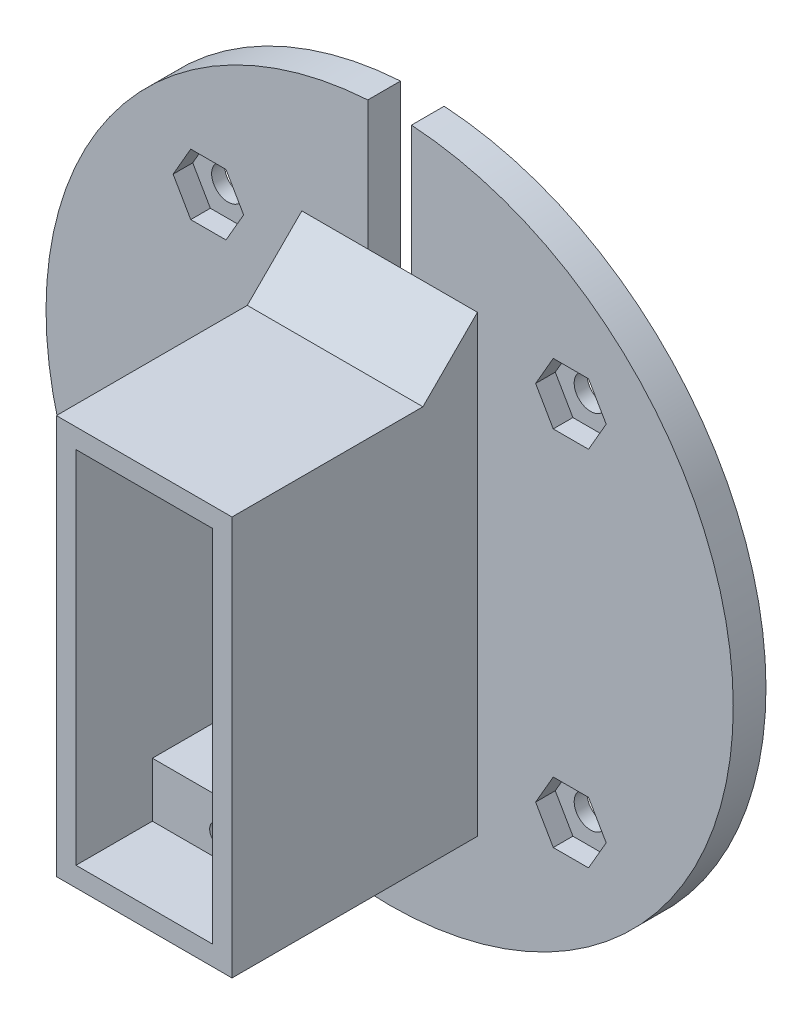
from build123d import *

# Parameters (mm, degrees)
CROQUIS1_R              = 31.5
SALIENTE_EXTRUIR1_DEPTH = 2.4
CROQUIS2_W              = 16.1
CROQUIS2_H              = 36.6
CROQUIS2_W_2            = 12.5
CROQUIS2_H_2            = 33
SALIENTE_EXTRUIR2_DEPTH = 22.5
CROQUIS5_W              = 16.1
CROQUIS5_H              = 36.6
CORTAR_EXTRUIR2_DEPTH   = 9
CROQUIS6_R              = 1.5
CORTAR_EXTRUIR3_DEPTH   = 2.4
CROQUIS7_W              = 12.5
CROQUIS7_H              = 9
SALIENTE_EXTRUIR3_DEPTH = 33
CROQUIS8_R              = 1
CORTAR_EXTRUIR5_DEPTH   = 9
SALIENTE_EXTRUIR4_DEPTH = 12.5
CROQUIS10_W             = 4
CROQUIS10_H             = 2
CORTAR_EXTRUIR6_DEPTH   = 9
SALIENTE_EXTRUIR5_DEPTH = 2.4
SALIENTE_EXTRUIR6_DEPTH = 16.1
CORTAR_EXTRUIR7_DEPTH   = 1.8
CROQUIS14_R             = 1.5
SALIENTE_EXTRUIR7_DEPTH = 0.6


with BuildPart() as part:
    # Croquis1 → Saliente-Extruir1 (new body)
    with BuildSketch(Plane.XY):
        with Locations((-51.235671923, 9.786589019)):
            Circle(CROQUIS1_R)
    extrude(amount=SALIENTE_EXTRUIR1_DEPTH)

    # Croquis2 → Saliente-Extruir2 (add)
    with BuildSketch(Plane.XY.offset(2.4)):
        with Locations((-51.235671923, 6.086589019)):
            Rectangle(CROQUIS2_W, CROQUIS2_H)
        with Locations((-51.235671923, 6.086589019)):
            Rectangle(CROQUIS2_W_2, CROQUIS2_H_2, mode=Mode.SUBTRACT)
    extrude(amount=SALIENTE_EXTRUIR2_DEPTH)

    # Croquis5 → Cortar-Extruir2 (cut)
    with BuildSketch(Plane.XY.offset(2.4)):
        with Locations((-51.235671923, 6.086589019)):
            Rectangle(CROQUIS5_W, CROQUIS5_H)
    extrude(amount=-CORTAR_EXTRUIR2_DEPTH, mode=Mode.SUBTRACT)


with BuildPart() as cortar_extruir2_piece_1:
    # of the separate pieces the step leaves, piece 1, a body of its own (cortar_extruir2_pieces)
    add(part.part.solids().sort_by_distance((-19.735671923, 9.786589019, 0))[0])

    # Croquis6 → Cortar-Extruir3 (cut)
    with BuildSketch(Plane(origin=(0, 0, 0), x_dir=(-1, 0, 0), z_dir=(0, 0, -1))):
        with Locations((34.618662565, 26.403598377)):
            Circle(CROQUIS6_R)
        with Locations((67.85268128, 26.403598377)):
            Circle(CROQUIS6_R)
        with Locations((67.85268128, -6.830420339)):
            Circle(CROQUIS6_R)
        with Locations((34.618662565, -6.830420339)):
            Circle(CROQUIS6_R)
        Polygon((51.235671923, 24.386589019), (53.235671923, 24.386589019), (53.235671923, 44.386589019), (49.235671923, 44.386589019), (49.235671923, 24.386589019), align=None)
    extrude(amount=-CORTAR_EXTRUIR3_DEPTH, mode=Mode.SUBTRACT)



with BuildPart() as cortar_extruir2_piece_2:
    # of the separate pieces the step leaves, piece 2, a body of its own (cortar_extruir2_pieces)
    add(part.part.solids().sort_by_distance((-59.285671923, -12.213410981, 24.9))[0])

    # Croquis7 → Saliente-Extruir3 (add)
    with BuildSketch(Plane.XZ.offset(-22.586589019)):
        with Locations((-51.235671923, 13.4)):
            Rectangle(CROQUIS7_W, CROQUIS7_H)
    extrude(amount=SALIENTE_EXTRUIR3_DEPTH)

    # Croquis8 → Cortar-Extruir5 (cut)
    with BuildSketch(Plane.XY.offset(17.9)):
        with Locations((-51.235671923, -8.413410981)):
            Circle(CROQUIS8_R)
        with Locations((-51.235671923, 20.636589019)):
            Circle(CROQUIS8_R)
        Polygon((-44.985671923, -5.413410981), (-57.485671923, -5.413410981), (-57.485671923, 17.586589019), (-53.235671923, 17.586589019), (-53.235671923, 19.586589019), (-49.235671923, 19.586589019), (-49.235671923, 17.586589019), (-44.985671923, 17.586589019), align=None)
    extrude(amount=-CORTAR_EXTRUIR5_DEPTH, mode=Mode.SUBTRACT)

    # Croquis9 → Saliente-Extruir4 (add)
    with BuildSketch(Plane.ZY.offset(44.985671923)):
        Polygon((8.9, -5.413410981), (3.9, -10.413410981), (8.9, -10.413410981), align=None)
        Polygon((8.9, 17.586589019), (3.9, 22.586589019), (8.9, 22.586589019), align=None)
    extrude(amount=SALIENTE_EXTRUIR4_DEPTH)

    # Croquis10 → Cortar-Extruir6 (cut)
    with BuildSketch(Plane.XY.offset(8.9)):
        with Locations((-51.235671923, 18.586589019)):
            Rectangle(CROQUIS10_W, CROQUIS10_H)
    extrude(amount=-CORTAR_EXTRUIR6_DEPTH, mode=Mode.SUBTRACT)


with BuildPart() as cortar_extruir2_piece_1_1:
    add(cortar_extruir2_piece_1.part)

    add(cortar_extruir2_piece_2.part)  # Saliente-Extruir5 merges Cortar-Extruir2 piece 2
    # Croquis11 → Saliente-Extruir5 (add)
    with BuildSketch(Plane(origin=(0, 0, 2.4), x_dir=(-1, 0, 0), z_dir=(0, 0, -1))):
        Polygon((49.235671923, 24.386589019), (43.185671923, 24.386589019), (43.185671923, -12.213410981), (59.285671923, -12.213410981), (59.285671923, 24.386589019), (53.235671923, 24.386589019), (53.235671923, 22.586589019), (57.485671923, 22.586589019), (57.485671923, 10.586589019), (44.985671923, 10.586589019), (44.985671923, 22.586589019), (49.235671923, 22.586589019), align=None)
    extrude(amount=SALIENTE_EXTRUIR5_DEPTH)

    # Croquis12 → Saliente-Extruir6 (add)
    with BuildSketch(Plane(origin=(-43.185671923, 0, 0), x_dir=(0, 0, -1), z_dir=(1, 0, 0))):
        Polygon((-2.4, 24.386589019), (-7.4, 24.386589019), (-2.4, 29.386589019), align=None)
    extrude(amount=-SALIENTE_EXTRUIR6_DEPTH)

    # Croquis13 → Cortar-Extruir7 (cut)
    with BuildSketch(Plane.XY.offset(2.4)):
        Polygon((-31.385501057, -6.830420339), (-33.002081811, -4.030420339), (-36.235243318, -4.030420339), (-37.851824072, -6.830420339), (-36.235243318, -9.630420339), (-33.002081811, -9.630420339), align=None)
        Polygon((-64.619519773, -6.830420339), (-66.236100527, -4.030420339), (-69.469262034, -4.030420339), (-71.085842788, -6.830420339), (-69.469262034, -9.630420339), (-66.236100527, -9.630420339), align=None)
        Polygon((-37.851824072, 26.403598377), (-36.235243318, 23.603598377), (-33.002081811, 23.603598377), (-31.385501057, 26.403598377), (-33.002081811, 29.203598377), (-36.235243318, 29.203598377), align=None)
        Polygon((-71.085842788, 26.403598377), (-69.469262034, 23.603598377), (-66.236100527, 23.603598377), (-64.619519773, 26.403598377), (-66.236100527, 29.203598377), (-69.469262034, 29.203598377), align=None)
    extrude(amount=-CORTAR_EXTRUIR7_DEPTH, mode=Mode.SUBTRACT)

    # Croquis14 → Saliente-Extruir7 (add)
    with BuildSketch(Plane(origin=(0, 0, 0), x_dir=(-1, 0, 0), z_dir=(0, 0, -1))):
        with BuildLine():
            Line((53.235671923, 41.223032838), (53.235671923, 22.586589019))
            Line((53.235671923, 22.586589019), (57.485671923, 22.586589019))
            Line((57.485671923, 22.586589019), (57.485671923, 10.586589019))
            Line((57.485671923, 10.586589019), (44.985671923, 10.586589019))
            Line((44.985671923, 10.586589019), (44.985671923, 22.586589019))
            Line((44.985671923, 22.586589019), (49.235671923, 22.586589019))
            Line((49.235671923, 22.586589019), (49.235671923, 41.223032838))
            ThreePointArc((49.235671923, 41.223032838), (51.235671923, -21.713410981), (53.235671923, 41.223032838))
        make_face()
        with Locations((67.85268128, -6.830420339)):
            Circle(CROQUIS14_R, mode=Mode.SUBTRACT)
        with Locations((34.618662565, -6.830420339)):
            Circle(CROQUIS14_R, mode=Mode.SUBTRACT)
        with Locations((34.618662565, 26.403598377)):
            Circle(CROQUIS14_R, mode=Mode.SUBTRACT)
        with Locations((67.85268128, 26.403598377)):
            Circle(CROQUIS14_R, mode=Mode.SUBTRACT)
    extrude(amount=SALIENTE_EXTRUIR7_DEPTH)


solid = cortar_extruir2_piece_1_1.part
